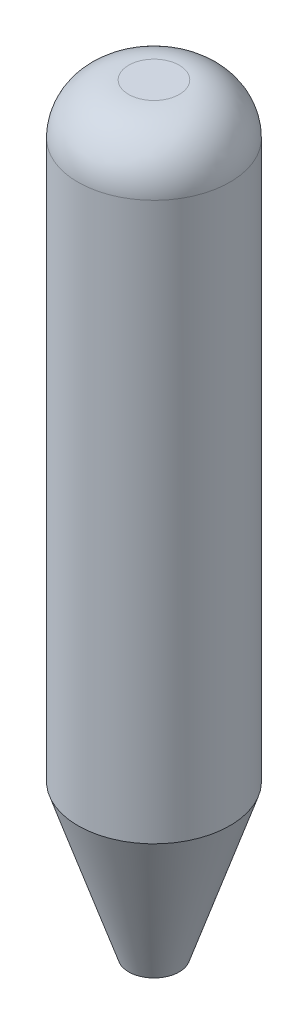
from build123d import *

# Parameters (mm, degrees)
CROQUIS1_R              = 15
SALIENTE_EXTRUIR1_DEPTH = 150
REDONDEO5_R             = 10
CHAFL_N2_SIZE           = 10
CHAFL_N2_SIZE2          = 30


with BuildPart() as part:
    # Croquis1 → Saliente-Extruir1 (new body)
    with BuildSketch(Plane(origin=(0, 0, 0), x_dir=(1, 0, 0), z_dir=(0, 1, 0))):
        with Locations(Location((0, 0, 0), (0, 0, 270))):
            Circle(CROQUIS1_R)
    extrude(amount=SALIENTE_EXTRUIR1_DEPTH)

    # Redondeo5
    redondeo5_edges = [part.edges().sort_by_distance(p)[0] for p in [
        (0, 150, -15),
    ]]
    fillet(redondeo5_edges, radius=REDONDEO5_R)

    # Chaflán2
    chafl_n2_edges = [part.edges().sort_by_distance(p)[0] for p in [
        (0, 0, -15),
    ]]
    chafl_n2_side = [part.faces().sort_by_distance(p)[0] for p in [
        (0, 0, 0),
    ]]
    chamfer(chafl_n2_edges, length=CHAFL_N2_SIZE, length2=CHAFL_N2_SIZE2, reference=chafl_n2_side[0])


solid = part.part
